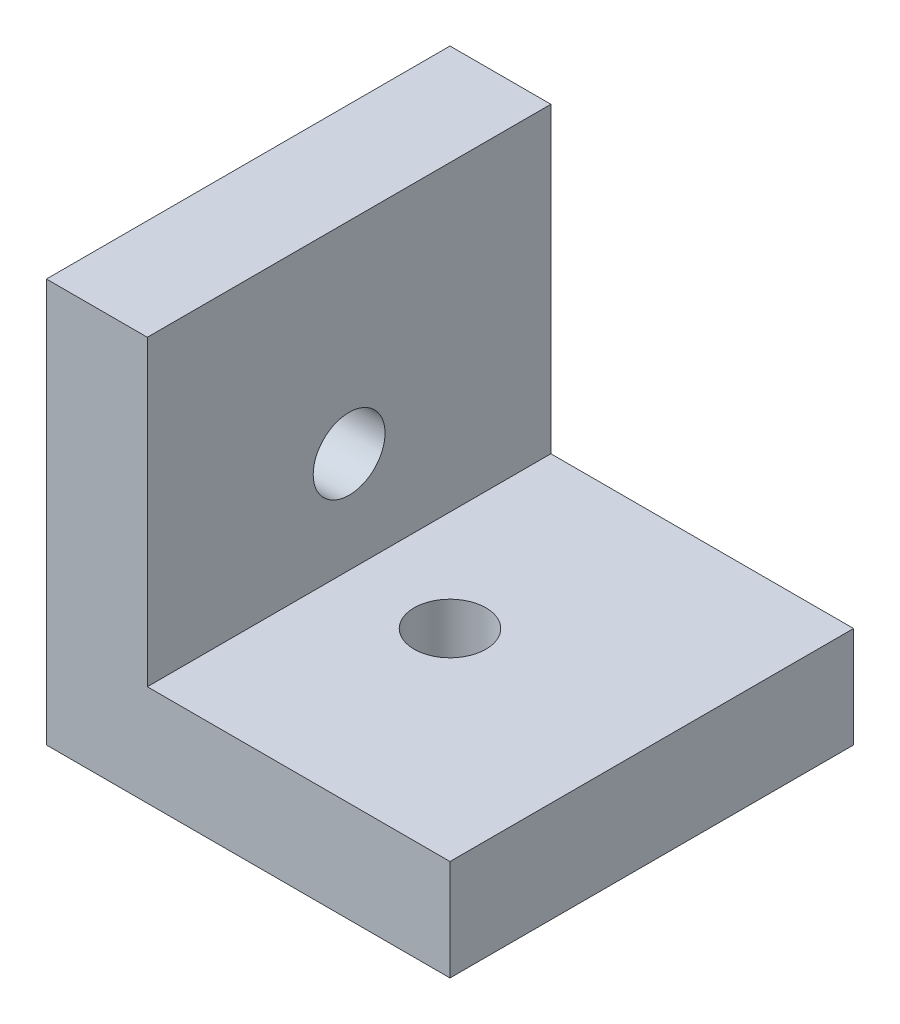
from build123d import *

# Parameters (mm, degrees)
BOSS_EXTRUDE1_DEPTH                 = 12.7
F_4_40_TAPPED_HOLE1_D               = 2.2606
F_4_40_TAPPED_HOLE1_DEPTH           = 7.62
F_4_40_TAPPED_HOLE1_TIP             = 0.679152758
F_4_40_TAPPED_HOLE1_ON_FACE_2_D     = 2.2606
F_4_40_TAPPED_HOLE1_ON_FACE_2_DEPTH = 7.62
F_4_40_TAPPED_HOLE1_ON_FACE_2_TIP   = 0.679152758


with BuildPart() as part:
    # Sketch1 → Boss-Extrude1 (new body)
    with BuildSketch(Plane.XY):
        Polygon((-0.520215582, 11.728087794), (2.654784418, 11.728087794), (2.654784418, 2.203087794), (12.179784418, 2.203087794), (12.179784418, -0.971912206), (-0.520215582, -0.971912206), align=None)
    extrude(amount=BOSS_EXTRUDE1_DEPTH)

    # #4-40 Tapped Hole1
    with Locations(Plane(origin=(-0.520215582, 5.378087794, 6.35), x_dir=(0, 0, -1), z_dir=(-1, 0, 0))):
        with Locations((0, 0)):
            Hole(F_4_40_TAPPED_HOLE1_D / 2, depth=F_4_40_TAPPED_HOLE1_DEPTH)
            with Locations((0, 0, -(F_4_40_TAPPED_HOLE1_DEPTH + F_4_40_TAPPED_HOLE1_TIP / 2))):  # 118° drill point
                Cone(0, F_4_40_TAPPED_HOLE1_D / 2, F_4_40_TAPPED_HOLE1_TIP, mode=Mode.SUBTRACT)

    # #4-40 Tapped Hole1 on face 2
    with Locations(Plane(origin=(5.829784418, -0.971912206, 6.35), x_dir=(0, 0, -1), z_dir=(0, -1, 0))):
        with Locations((0, 0)):
            Hole(F_4_40_TAPPED_HOLE1_ON_FACE_2_D / 2, depth=F_4_40_TAPPED_HOLE1_ON_FACE_2_DEPTH)
            with Locations((0, 0, -(F_4_40_TAPPED_HOLE1_ON_FACE_2_DEPTH + F_4_40_TAPPED_HOLE1_ON_FACE_2_TIP / 2))):  # 118° drill point
                Cone(0, F_4_40_TAPPED_HOLE1_ON_FACE_2_D / 2, F_4_40_TAPPED_HOLE1_ON_FACE_2_TIP, mode=Mode.SUBTRACT)


solid = part.part
